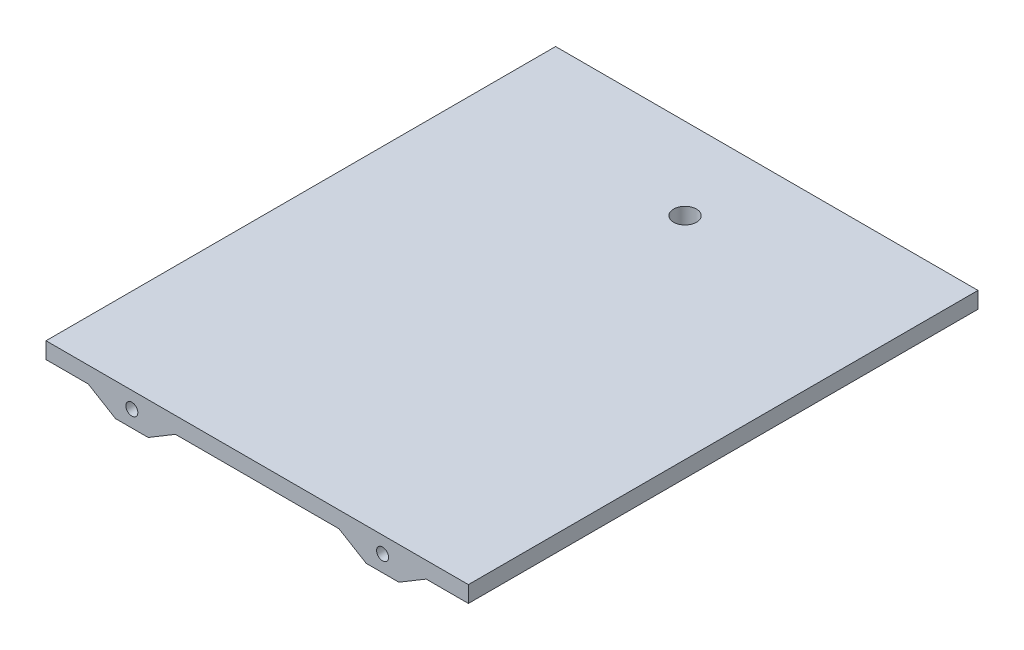
from build123d import *

# Parameters (mm, degrees)
SZKIC15_W                    = 77.5
SZKIC15_H                    = 93.5
DODANIE_WYCI_GNI_CIE12_DEPTH = 3
SZKIC17_W                    = 9
SZKIC17_H                    = 9
DODANIE_WYCI_GNI_CIE15_DEPTH = 3
DODANIE_WYCI_GNI_CIE16_DEPTH = 3
SZKIC22_R                    = 2.1
WYTNIJ_WYCI_GNI_CIE10_DEPTH  = 0.5
DODANIE_WYCI_GNI_CIE17_DEPTH = 10
WYTNIJ_WYCI_GNI_CIE12_DEPTH  = 10
SZKIC29_R                    = 2.1
WYTNIJ_WYCI_GNI_CIE13_DEPTH  = 10
WYTNIJ_WYCI_GNI_CIE14_DEPTH  = 30
WYTNIJ_WYCI_GNI_CIE15_DEPTH  = 30
DODANIE_WYCI_GNI_CIE18_DEPTH = 10
WYTNIJ_WYCI_GNI_CIE16_START  = -10
SZKIC32_3_R                  = 1.1
WYTNIJ_WYCI_GNI_CIE16_DEPTH  = 10


with BuildPart() as part:
    # Szkic15 → Dodanie-wyciągnięcie12 (new body)
    with BuildSketch(Plane(origin=(0, 0, 0), x_dir=(1, 0, 0), z_dir=(0, 1, 0))):
        with Locations((0, 22.56238879)):
            Rectangle(SZKIC15_W, SZKIC15_H)
    extrude(amount=DODANIE_WYCI_GNI_CIE12_DEPTH)

    # Szkic17 → Dodanie-wyciągnięcie15 (add)
    with BuildSketch(Plane.XZ):
        Polygon((-15, -9.31238879), (15, -9.31238879), (15, -39.31238879), (30, -39.31238879), (30, -69.31238879), (15, -69.31238879), (-18.132258098, -69.31238879), (-30, -69.31238879), (-30, -39.31238879), (-15, -39.31238879), align=None)
        with Locations((0, -54.31238879)):
            Rectangle(SZKIC17_W, SZKIC17_H, mode=Mode.SUBTRACT)
    extrude(amount=DODANIE_WYCI_GNI_CIE15_DEPTH)

    # Szkic18 → Dodanie-wyciągnięcie16 (add)
    with BuildSketch(Plane.XZ.offset(3)):
        Polygon((-15, -9.31238879), (-15, -39.31238879), (-30, -39.31238879), (-30, -69.31238879), (30, -69.31238879), (30, -39.31238879), (15, -39.31238879), (15, -9.31238879), align=None)
    extrude(amount=DODANIE_WYCI_GNI_CIE16_DEPTH)

    # Szkic22 → Wytnij-wyciągnięcie10 (cut)
    with BuildSketch(Plane(origin=(0, 3, 0), x_dir=(1, 0, 0), z_dir=(0, 1, 0))):
        with Locations(Location((0, 54.31238879, 0), (0, 0, 270))):
            Circle(SZKIC22_R)
    extrude(amount=-WYTNIJ_WYCI_GNI_CIE10_DEPTH, mode=Mode.SUBTRACT)

    # Szkic27 → Dodanie-wyciągnięcie17 (add)
    with BuildSketch(Plane.XY.offset(24.18761121)):
        with BuildLine():
            Line((-24.1, 0), (-26, 0))
            Line((-26, 0), (-26, -3))
            Line((-26, -3), (-20, -3))
            Line((-20, -3), (-20, 0))
            Line((-20, 0), (-21.9, 0))
            ThreePointArc((-21.9, 0), (-23, -1.1), (-24.1, 0))
        make_face()
        with BuildLine():
            Line((-21.9, 0), (-24.1, 0))
            ThreePointArc((-24.1, 0), (-23, -1.1), (-21.9, 0))
        make_face()
        with BuildLine():
            ThreePointArc((-21.9, 0), (-23, 1.1), (-24.1, 0))
            Line((-24.1, 0), (-21.9, 0))
        make_face()
        with BuildLine():
            Line((24.1, 0), (21.9, 0))
            ThreePointArc((21.9, 0), (23, -1.1), (24.1, 0))
        make_face()
        with BuildLine():
            ThreePointArc((24.1, 0), (23, 1.1), (21.9, 0))
            Line((21.9, 0), (24.1, 0))
        make_face()
        with BuildLine():
            Line((20, 0), (20, -3))
            Line((20, -3), (26, -3))
            Line((26, -3), (26, 0))
            Line((26, 0), (24.1, 0))
            ThreePointArc((24.1, 0), (23, -1.1), (21.9, 0))
            Line((21.9, 0), (20, 0))
        make_face()
        Polygon((-26, -3), (-26, 0), (-31, 0), align=None)
        Polygon((-15, 0), (-20, 0), (-20, -3), align=None)
        Polygon((20, 0), (15, 0), (20, -3), align=None)
        Polygon((26, 0), (26, -3), (31, 0), align=None)
    extrude(amount=-DODANIE_WYCI_GNI_CIE17_DEPTH)

    # Szkic27<5> → Wytnij-wyciągnięcie12 (cut)
    with BuildSketch(Plane.XY.offset(24.18761121)):
        with BuildLine():
            Line((-21.9, 0), (-24.1, 0))
            ThreePointArc((-24.1, 0), (-23, -1.1), (-21.9, 0))
        make_face()
        with BuildLine():
            ThreePointArc((-21.9, 0), (-23, 1.1), (-24.1, 0))
            Line((-24.1, 0), (-21.9, 0))
        make_face()
        with BuildLine():
            Line((24.1, 0), (21.9, 0))
            ThreePointArc((21.9, 0), (23, -1.1), (24.1, 0))
        make_face()
        with BuildLine():
            ThreePointArc((24.1, 0), (23, 1.1), (21.9, 0))
            Line((21.9, 0), (24.1, 0))
        make_face()
    extrude(amount=-WYTNIJ_WYCI_GNI_CIE12_DEPTH, mode=Mode.SUBTRACT)

    # Szkic29 → Wytnij-wyciągnięcie13 (cut)
    with BuildSketch(Plane(origin=(0, 2.5, 0), x_dir=(1, 0, 0), z_dir=(0, 1, 0))):
        with Locations(Location((0, 54.31238879, 0), (0, 0, 270))):
            Circle(SZKIC29_R)
    extrude(amount=-WYTNIJ_WYCI_GNI_CIE13_DEPTH, mode=Mode.SUBTRACT)

    # Szkic30 → Wytnij-wyciągnięcie14 (cut)
    with BuildSketch(Plane.XY.offset(-39.31238879)):
        Polygon((15, -6), (30, 0), (30, -6), align=None)
        Polygon((-15, -6), (-30, 0), (-30, -6), align=None)
    extrude(amount=-WYTNIJ_WYCI_GNI_CIE14_DEPTH, mode=Mode.SUBTRACT)

    # Szkic31 → Wytnij-wyciągnięcie15 (cut)
    with BuildSketch(Plane.ZY.offset(15)):
        Polygon((-39.31238879, -6), (-9.31238879, 0), (-9.31238879, -6), align=None)
    extrude(amount=-WYTNIJ_WYCI_GNI_CIE15_DEPTH, mode=Mode.SUBTRACT)

    # Szkic32 → Dodanie-wyciągnięcie18 (add)
    with BuildSketch(Plane(origin=(0, 0, -69.31238879), x_dir=(-1, 0, 0), z_dir=(0, 0, -1))):
        Polygon((-31, 0), (-26, -3), (-26, -1.6), (-30, 0), align=None)
        Polygon((-26, -3), (-22.5, -3), (-26, -1.6), align=None)
        Polygon((22.5, -3), (26, -3), (26, -1.6), align=None)
        Polygon((26, -1.6), (26, -3), (31, 0), (30, 0), align=None)
    extrude(amount=-DODANIE_WYCI_GNI_CIE18_DEPTH)

    # Szkic32<3> → Wytnij-wyciągnięcie16 (cut)
    with BuildSketch(Plane(origin=(0, 0, -69.31238879), x_dir=(-1, 0, 0), z_dir=(0, 0, -1)).offset(WYTNIJ_WYCI_GNI_CIE16_START)):
        with Locations(Location((-23, 0, 0), (0, 0, 180))):
            Circle(SZKIC32_3_R)
        with Locations(Location((23, 0, 0), (0, 0, 180))):
            Circle(SZKIC32_3_R)
    extrude(amount=WYTNIJ_WYCI_GNI_CIE16_DEPTH, mode=Mode.SUBTRACT)


solid = part.part
